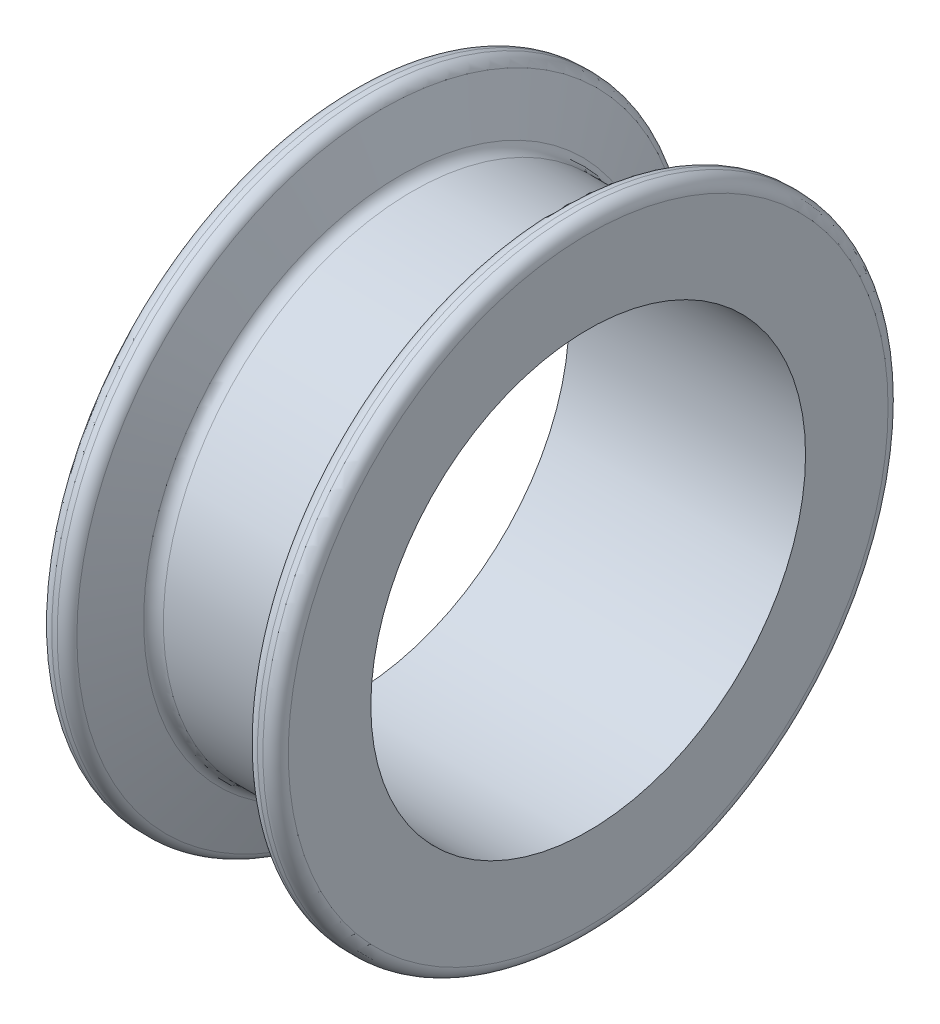
from build123d import *


with BuildPart() as part:
    # Sketch1 → Revolve1 (revolve)
    with BuildSketch(Plane.XY, mode=Mode.PRIVATE) as revolve1_sk:
        with BuildLine():
            Line((215.569737887, -120.531915067), (223.024189817, -120.531915067))
            Line((223.024189817, -120.531915067), (223.024189817, -123.131915067))
            ThreePointArc((223.024189817, -123.131915067), (222.90703253, -123.41475778), (222.624189817, -123.531915067))
            Line((222.624189817, -123.531915067), (222.453461469, -123.531915067))
            ThreePointArc((222.453461469, -123.531915067), (222.22974276, -123.463502069), (222.08255039, -123.281664764))
            Line((222.08255039, -123.281664764), (221.477150355, -121.78216537))
            ThreePointArc((221.477150355, -121.78216537), (221.329957985, -121.600328066), (221.106239276, -121.531915067))
            Line((221.106239276, -121.531915067), (217.487688428, -121.531915067))
            ThreePointArc((217.487688428, -121.531915067), (217.26396972, -121.600328066), (217.11677735, -121.78216537))
            Line((217.11677735, -121.78216537), (216.511377314, -123.281664764))
            ThreePointArc((216.511377314, -123.281664764), (216.364184944, -123.463502069), (216.140466236, -123.531915067))
            Line((216.140466236, -123.531915067), (215.969737887, -123.531915067))
            ThreePointArc((215.969737887, -123.531915067), (215.686895175, -123.41475778), (215.569737887, -123.131915067))
            Line((215.569737887, -123.131915067), (215.569737887, -120.531915067))
        make_face()
    revolve(revolve1_sk.sketch.rotate(Axis((220.434983076, -113.681915067, 0), (-1, 0, 0)), 270), axis=Axis((220.434983076, -113.681915067, 0), (-1, 0, 0)))


solid = part.part
